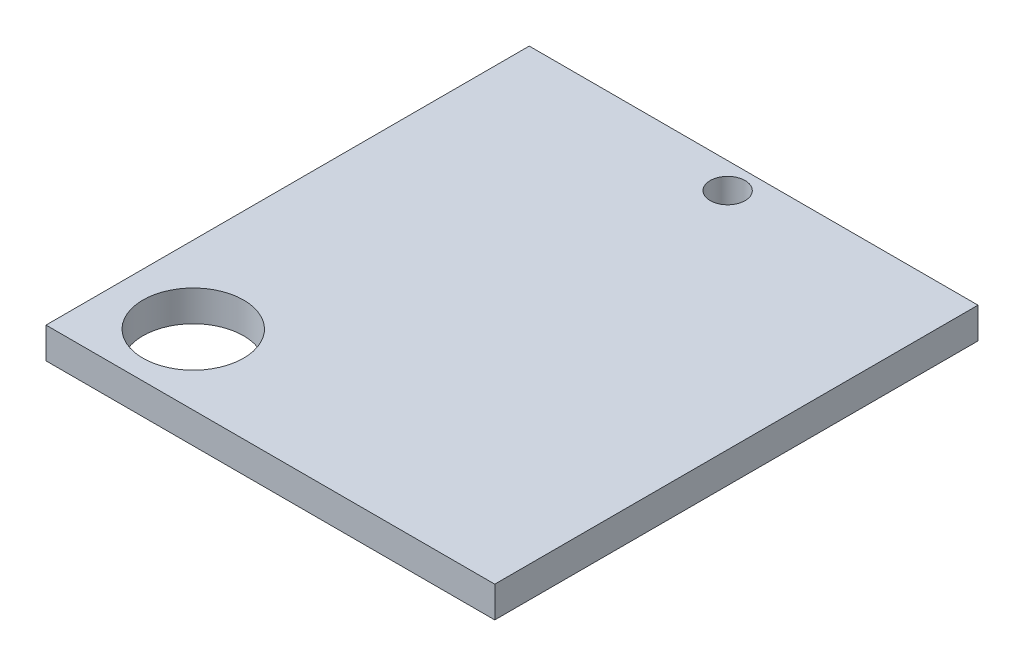
from build123d import *

# Parameters (mm, degrees)
ESQUISSE2_W             = 57.9
ESQUISSE2_H             = 62.35
BOSS_EXTRU_1_DEPTH      = 4
ESQUISSE3_R             = 6.5
ENL_V_MAT_EXTRU_1_DEPTH = 51.389483469
ESQUISSE4_R             = 2.25
ENL_V_MAT_EXTRU_2_DEPTH = 10


with BuildPart() as part:
    # Esquisse2 → Boss.-Extru.1 (new body)
    with BuildSketch(Plane(origin=(0, 0, 0), x_dir=(1, 0, 0), z_dir=(0, 1, 0))):
        with Locations((0, -9.873721591)):
            Rectangle(ESQUISSE2_W, ESQUISSE2_H)
    extrude(amount=BOSS_EXTRU_1_DEPTH)

    # Esquisse3 → Enlèv. mat.-Extru.1 (cut, through all)
    with BuildSketch(Plane.XZ):
        with Locations(Location((-19, 32, 0), (0, 0, 270))):
            Circle(ESQUISSE3_R)
    extrude(amount=-ENL_V_MAT_EXTRU_1_DEPTH, mode=Mode.SUBTRACT)

    # Esquisse4 → Enlèv. mat.-Extru.2 (cut)
    with BuildSketch(Plane(origin=(0, 4, 0), x_dir=(1, 0, 0), z_dir=(0, 1, 0))):
        with Locations(Location((0, 17.951278409, 0), (0, 0, 270))):
            Circle(ESQUISSE4_R)
    extrude(amount=-ENL_V_MAT_EXTRU_2_DEPTH, mode=Mode.SUBTRACT)


solid = part.part
